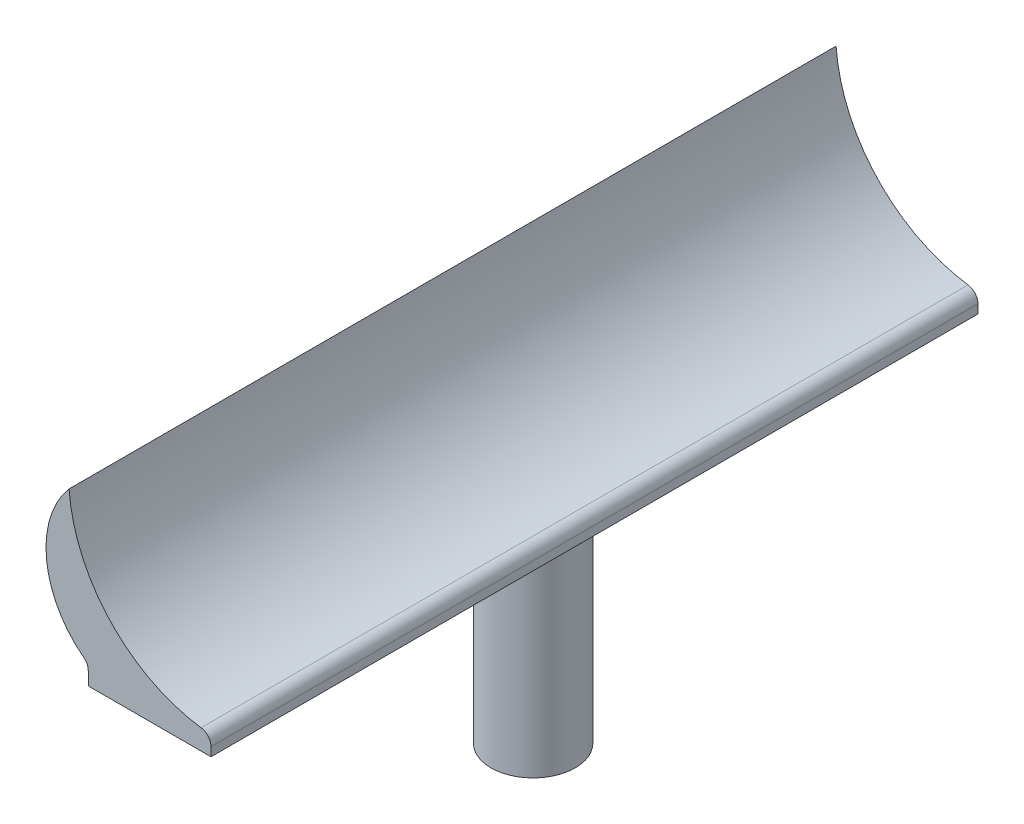
from build123d import *

# Parameters (mm, degrees)
SKETCH1_R           = 11
BOSS_EXTRUDE1_DEPTH = 55
BOSS_EXTRUDE2_DEPTH = 100
FILLET1_R           = 3


with BuildPart() as part:
    # Sketch1 → Boss-Extrude1 (new body)
    with BuildSketch(Plane(origin=(0, 0, 0), x_dir=(1, 0, 0), z_dir=(0, 1, 0))):
        with Locations(Location((0, 0, 0), (0, 0, 270))):
            Circle(SKETCH1_R)
    extrude(amount=BOSS_EXTRUDE1_DEPTH)

    # Sketch2 → Boss-Extrude2 (add, symmetric)
    with BuildSketch(Plane.XY):
        with BuildLine():
            Line((-16, 55), (16, 55))
            Line((16, 55), (16, 60))
            ThreePointArc((16, 60), (-9.389178352, 71.610821648), (-21, 97))
            ThreePointArc((-21, 97), (-26.796302084, 77.378878097), (-16, 60))
            Line((-16, 60), (-16, 55))
        make_face()
    extrude(amount=BOSS_EXTRUDE2_DEPTH, both=True)

    # Fillet1
    fillet1_edges = [part.edges().sort_by_distance(p)[0] for p in [
        (-16, 60, 0),
        (16, 60, 0),
    ]]
    fillet(fillet1_edges, radius=FILLET1_R)


solid = part.part
